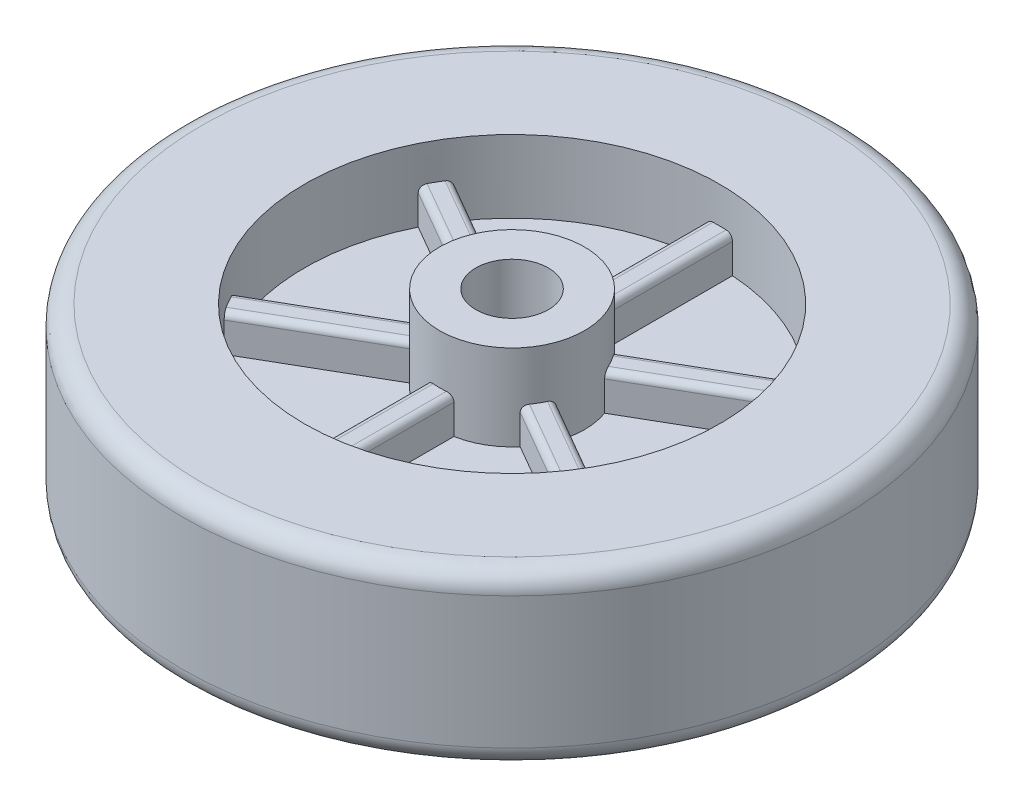
from build123d import *

# Parameters (mm, degrees)
BOSS_EXTRUDE1_DEPTH      = 13
BOSS_EXTRUDE1_DEPTH_BACK = 13
SKETCH1_R                = 50
SKETCH1_R_2              = 31.5
BOSS_EXTRUDE2_DEPTH      = 15
BOSS_EXTRUDE2_DEPTH_BACK = 15
SKETCH1_3_R              = 11
SKETCH1_3_R_2            = 5.5
BOSS_EXTRUDE3_DEPTH      = 7.5
BOSS_EXTRUDE3_DEPTH_BACK = 7.5
BOSS_EXTRUDE4_DEPTH      = 2
BOSS_EXTRUDE4_DEPTH_BACK = 2
SKETCH2_3_R              = 31.5
FILLET1_R                = 1
FILLET2_R                = 3
CUT_EXTRUDE1_DEPTH       = 73.284161495
CUT_EXTRUDE1_DEPTH_BACK  = 73.284161495
SKETCH1_4_R              = 5.5


with BuildPart() as part:
    # Sketch1 → Boss-Extrude1 (new, two sides: drawn at the far end of the back side and taken through both)
    with BuildSketch(Plane(origin=(0, 0, 0), x_dir=(1, 0, 0), z_dir=(0, 1, 0)).offset(-BOSS_EXTRUDE1_DEPTH_BACK)):
        Circle(SKETCH1_R)
        Circle(SKETCH1_R_2, mode=Mode.SUBTRACT)
    extrude(amount=BOSS_EXTRUDE1_DEPTH + BOSS_EXTRUDE1_DEPTH_BACK)



with BuildPart() as body_2:
    # Sketch1<3> → Boss-Extrude2 (new, two sides: drawn at the far end of the back side and taken through both)
    with BuildSketch(Plane(origin=(0, 0, 0), x_dir=(1, 0, 0), z_dir=(0, 1, 0)).offset(-BOSS_EXTRUDE2_DEPTH_BACK)):
        Circle(SKETCH1_3_R)
        Circle(SKETCH1_3_R_2, mode=Mode.SUBTRACT)
    extrude(amount=BOSS_EXTRUDE2_DEPTH + BOSS_EXTRUDE2_DEPTH_BACK)


with BuildPart() as part_1:
    add(part.part)

    add(body_2.part)  # Boss-Extrude3 merges body 2
    # Sketch2 → Boss-Extrude3 (add, two sides: drawn at the far end of the back side and taken through both)
    with BuildSketch(Plane(origin=(0, 0, 0), x_dir=(1, 0, 0), z_dir=(0, 1, 0)).offset(-BOSS_EXTRUDE3_DEPTH_BACK)):
        with BuildLine():
            ThreePointArc((2, 31.436443819), (0, 31.5), (-2, 31.436443819))
            Line((-2, 31.436443819), (-2, 10.816653826))
            ThreePointArc((-2, 10.816653826), (0, 11), (2, 10.816653826))
            Line((2, 10.816653826), (2, 31.436443819))
        make_face()
        with BuildLine():
            Line((-8.367496998, 7.140377721), (-26.224758952, 17.450272717))
            ThreePointArc((-26.224758952, 17.450272717), (-27.279800219, 15.75), (-28.224758952, 13.986171102))
            Line((-28.224758952, 13.986171102), (-10.367496998, 3.676276106))
            ThreePointArc((-10.367496998, 3.676276106), (-9.526279442, 5.5), (-8.367496998, 7.140377721))
        make_face()
        with BuildLine():
            ThreePointArc((28.224758952, 13.986171102), (27.279800219, 15.75), (26.224758952, 17.450272717))
            Line((26.224758952, 17.450272717), (8.367496998, 7.140377721))
            ThreePointArc((8.367496998, 7.140377721), (9.526279442, 5.5), (10.367496998, 3.676276106))
            Line((10.367496998, 3.676276106), (28.224758952, 13.986171102))
        make_face()
        with BuildLine():
            Line((-10.367496998, -3.676276106), (-28.224758952, -13.986171102))
            ThreePointArc((-28.224758952, -13.986171102), (-27.279800219, -15.75), (-26.224758952, -17.450272717))
            Line((-26.224758952, -17.450272717), (-8.367496998, -7.140377721))
            ThreePointArc((-8.367496998, -7.140377721), (-9.526279442, -5.5), (-10.367496998, -3.676276106))
        make_face()
        with BuildLine():
            ThreePointArc((26.224758952, -17.450272717), (27.279800219, -15.75), (28.224758952, -13.986171102))
            Line((28.224758952, -13.986171102), (10.367496998, -3.676276106))
            ThreePointArc((10.367496998, -3.676276106), (9.526279442, -5.5), (8.367496998, -7.140377721))
            Line((8.367496998, -7.140377721), (26.224758952, -17.450272717))
        make_face()
        with BuildLine():
            Line((-2, -10.816653826), (-2, -31.436443819))
            ThreePointArc((-2, -31.436443819), (0, -31.5), (2, -31.436443819))
            Line((2, -31.436443819), (2, -10.816653826))
            ThreePointArc((2, -10.816653826), (0, -11), (-2, -10.816653826))
        make_face()
    extrude(amount=BOSS_EXTRUDE3_DEPTH + BOSS_EXTRUDE3_DEPTH_BACK)

    # Sketch2<3> → Boss-Extrude4 (add, two sides: drawn at the far end of the back side and taken through both)
    with BuildSketch(Plane(origin=(0, 0, 0), x_dir=(1, 0, 0), z_dir=(0, 1, 0)).offset(-BOSS_EXTRUDE4_DEPTH_BACK)):
        Circle(SKETCH2_3_R)
    extrude(amount=BOSS_EXTRUDE4_DEPTH + BOSS_EXTRUDE4_DEPTH_BACK)

    # Fillet1
    fillet1_edges = [part_1.edges().sort_by_distance(p)[0] for p in [
        (19.296127975, -7.5, -8.831223604),
        (17.296127975, -7.5, -12.295325219),
        (2, -7.5, -21.126548823),
        (-2, -7.5, -21.126548823),
        (-17.296127975, -7.5, -12.295325219),
        (-19.296127975, -7.5, -8.831223604),
        (-19.296127975, -7.5, 8.831223604),
        (-17.296127975, -7.5, 12.295325219),
        (-2, -7.5, 21.126548823),
        (2, -7.5, 21.126548823),
        (-19.296127975, 7.5, 8.831223604),
        (-17.296127975, 7.5, 12.295325219),
        (-2, 7.5, 21.126548823),
        (2, 7.5, 21.126548823),
        (17.296127975, 7.5, 12.295325219),
        (19.296127975, 7.5, 8.831223604),
        (19.296127975, 7.5, -8.831223604),
        (17.296127975, 7.5, -12.295325219),
        (2, 7.5, -21.126548823),
        (-2, 7.5, -21.126548823),
        (-17.296127975, 7.5, -12.295325219),
        (-19.296127975, 7.5, -8.831223604),
        (19.296127975, -7.5, 8.831223604),
        (17.296127975, -7.5, 12.295325219),
    ]]
    fillet(fillet1_edges, radius=FILLET1_R)

    # Fillet2
    fillet2_edges = [part_1.edges().sort_by_distance(p)[0] for p in [
        (-50, -13, 0),
        (-50, 13, 0),
    ]]
    fillet(fillet2_edges, radius=FILLET2_R)

    # Sketch1<4> → Cut-Extrude1 (cut, two sides: drawn at the far end of the back side and taken through both)
    with BuildSketch(Plane(origin=(0, 0, 0), x_dir=(1, 0, 0), z_dir=(0, 1, 0)).offset(-CUT_EXTRUDE1_DEPTH_BACK)):
        Circle(SKETCH1_4_R)
    extrude(amount=CUT_EXTRUDE1_DEPTH + CUT_EXTRUDE1_DEPTH_BACK, mode=Mode.SUBTRACT)


solid = part_1.part
